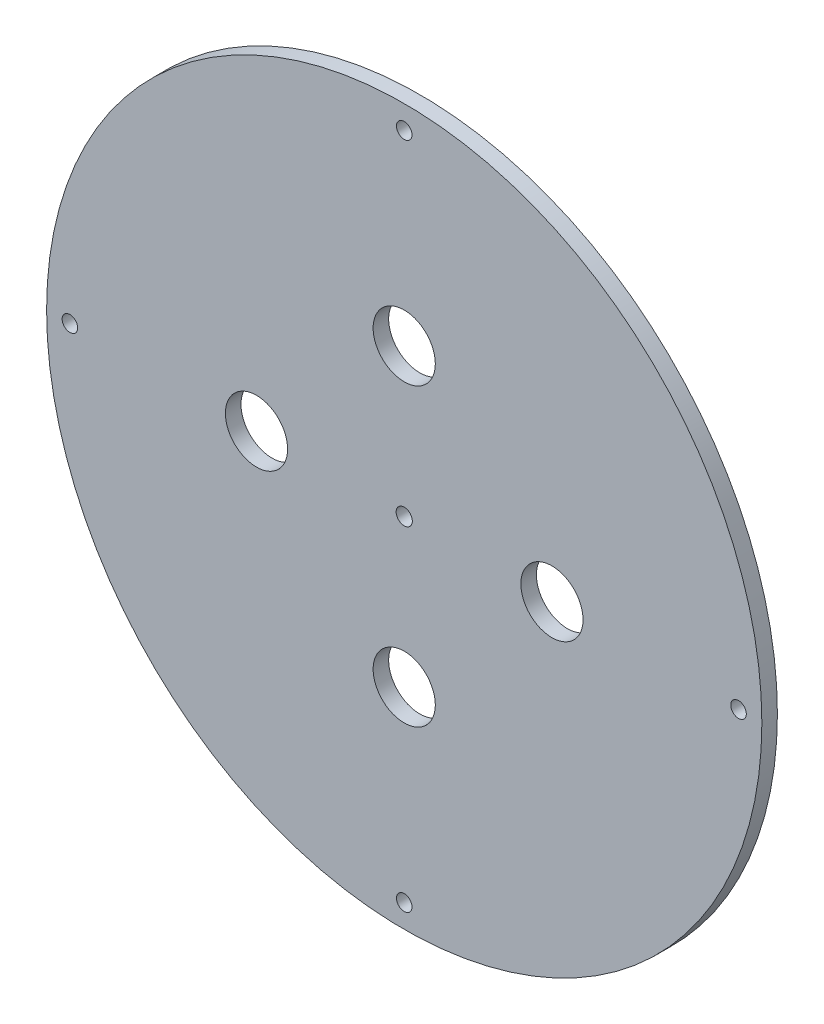
from build123d import *

# Parameters (mm, degrees)
SKETCH1_R           = 146.05
SKETCH1_R_2         = 3.175
SKETCH1_R_3         = 12.7
SKETCH1_R_4         = 3.302
BOSS_EXTRUDE1_DEPTH = 6.35


with BuildPart() as part:
    # Sketch1 → Boss-Extrude1 (new body)
    with BuildSketch(Plane.XY):
        Circle(SKETCH1_R)
        with Locations((0, 136.525)):
            Circle(SKETCH1_R_2, mode=Mode.SUBTRACT)
        with Locations((136.525, 0)):
            Circle(SKETCH1_R_2, mode=Mode.SUBTRACT)
        with Locations((0, -136.525)):
            Circle(SKETCH1_R_2, mode=Mode.SUBTRACT)
        with Locations((-136.525, 0)):
            Circle(SKETCH1_R_2, mode=Mode.SUBTRACT)
        with Locations((0, 60.325)):
            Circle(SKETCH1_R_3, mode=Mode.SUBTRACT)
        with Locations((60.325, 0)):
            Circle(SKETCH1_R_3, mode=Mode.SUBTRACT)
        with Locations((0, -60.325)):
            Circle(SKETCH1_R_3, mode=Mode.SUBTRACT)
        with Locations((-60.325, 0)):
            Circle(SKETCH1_R_3, mode=Mode.SUBTRACT)
        Circle(SKETCH1_R_4, mode=Mode.SUBTRACT)
    extrude(amount=BOSS_EXTRUDE1_DEPTH)


solid = part.part
